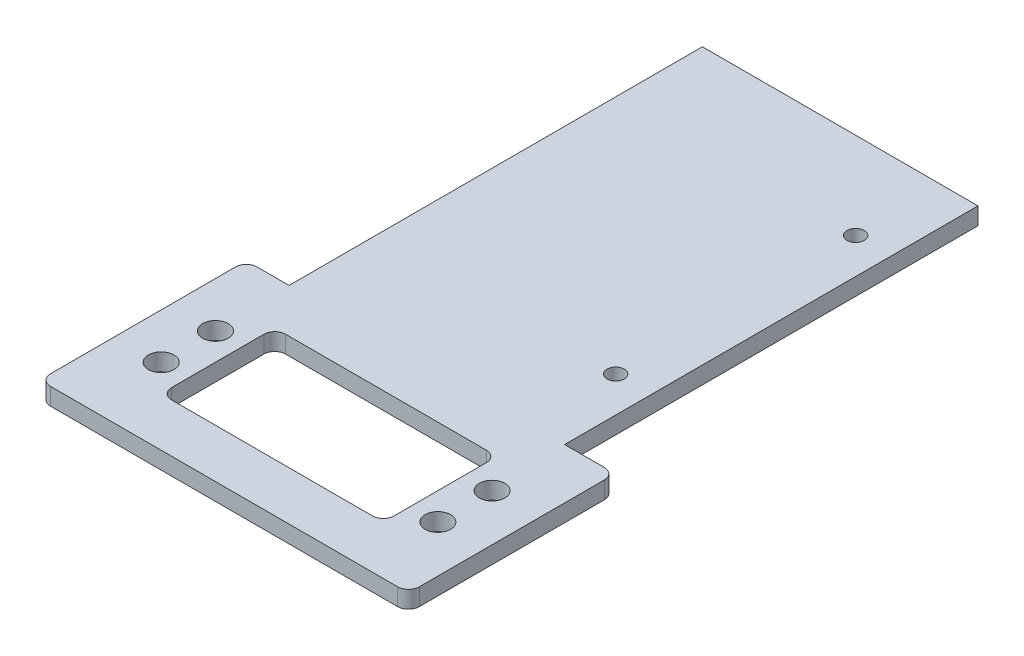
from build123d import *

# Parameters (mm, degrees)
BOSS_EXTRUDE1_DEPTH = 3.175
SKETCH2_R           = 2.35
SKETCH2_W           = 41
SKETCH2_H           = 21
CUT_EXTRUDE1_DEPTH  = 102.186180504
FILLET1_R           = 2
SKETCH5_R           = 1.5875
CUT_EXTRUDE2_DEPTH  = 102.186180504


with BuildPart() as part:
    # Sketch1 → Boss-Extrude1 (new body)
    with BuildSketch(Plane(origin=(0, 0, 0), x_dir=(1, 0, 0), z_dir=(0, 1, 0))):
        Polygon((-26.115438157, 19.05), (-34, 19.05), (-34, -19.05), (34, -19.05), (34, 19.05), (24.684561843, 19.05), (24.684561843, 95.25), (-26.115438157, 95.25), align=None)
    extrude(amount=BOSS_EXTRUDE1_DEPTH)

    # Sketch2 → Cut-Extrude1 (cut, through all)
    with BuildSketch(Plane(origin=(0, 3.175, 0), x_dir=(1, 0, 0), z_dir=(0, 1, 0))):
        with Locations(Location((-25.640438157, 5, 0), (0, 0, 270))):
            Circle(SKETCH2_R)
        with Locations(Location((-25.640438157, -5, 0), (0, 0, 270))):
            Circle(SKETCH2_R)
        with Locations(Location((25.359561843, -5, 0), (0, 0, 90))):
            Circle(SKETCH2_R)
        with Locations(Location((25.359561843, 5, 0), (0, 0, 90))):
            Circle(SKETCH2_R)
        with Locations((-0.140438157, 0.440263383)):
            Rectangle(SKETCH2_W, SKETCH2_H)
    extrude(amount=-CUT_EXTRUDE1_DEPTH, mode=Mode.SUBTRACT)

    # Fillet1
    fillet1_edges = [part.edges().sort_by_distance(p)[0] for p in [
        (-34, 1.5875, -19.05),
        (34, 1.5875, -19.05),
        (34, 1.5875, 19.05),
        (-34, 1.5875, 19.05),
        (-20.640438157, 1.5875, 10.059736617),
        (-20.640438157, 1.5875, -10.940263383),
        (20.359561843, 1.5875, -10.940263383),
        (20.359561843, 1.5875, 10.059736617),
    ]]
    fillet(fillet1_edges, radius=FILLET1_R)

    # Sketch5 → Cut-Extrude2 (cut, through all)
    with BuildSketch(Plane(origin=(0, 3.175, 0), x_dir=(1, 0, 0), z_dir=(0, 1, 0))):
        with Locations(Location((18.134561843, 79.248, 0), (0, 0, 270))):
            Circle(SKETCH5_R)
        with Locations(Location((18.134561843, 34.998, 0), (0, 0, 270))):
            Circle(SKETCH5_R)
    extrude(amount=-CUT_EXTRUDE2_DEPTH, mode=Mode.SUBTRACT)


solid = part.part
